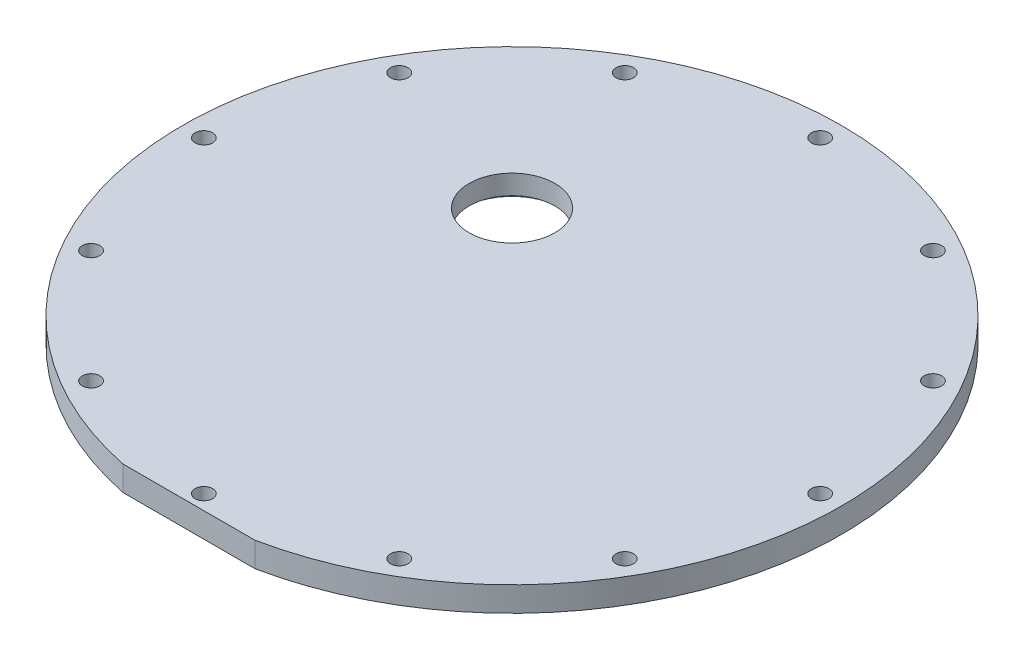
from build123d import *

# Parameters (mm, degrees)
SKETCH1_W               = 127
SKETCH1_H               = 9.525
F_1_4_CLEARANCE_HOLE1_D = 6.7564
CUT_EXTRUDE1_REACH      = 181.858
SKETCH4_W               = 50.8
SKETCH4_H               = 2.565921067
CUT_EXTRUDE2_REACH      = 181.858
SKETCH6_R               = 16.51
SKETCH7_R               = 19
CUT_EXTRUDE3_DEPTH      = 2


with BuildPart() as part:
    # Sketch1 → Revolve1 (revolve)
    with BuildSketch(Plane.XY, mode=Mode.PRIVATE) as revolve1_sk:
        with Locations((63.5, 4.7625)):
            Rectangle(SKETCH1_W, SKETCH1_H)
    revolve(revolve1_sk.sketch.rotate(Axis((0, 0, 0), (0, 1, 0)), 90), axis=Axis((0, 0, 0), (0, 1, 0)))

    # 1/4 Clearance Hole1 (through all)
    with Locations(Plane(origin=(0, 9.525, 0), x_dir=(1, 0, 0), z_dir=(0, 1, 0))):
        with Locations((0, 118.745), (59.3725, 102.836186572), (102.836186572, 59.3725), (118.745, 0), (102.836186572, -59.3725), (59.3725, -102.836186572), (0, -118.745), (-59.3725, -102.836186572), (-102.836186572, -59.3725), (-118.745, 0), (-102.836186572, 59.3725), (-59.3725, 102.836186572)):
            Hole(F_1_4_CLEARANCE_HOLE1_D / 2)

    # Sketch4 → Cut-Extrude1 (cut, up to next)
    with BuildSketch(Plane(origin=(0, 9.525, 0), x_dir=(1, 0, 0), z_dir=(0, 1, 0)), mode=Mode.PRIVATE) as cut_extrude1_sk1:
        with Locations((0, -125.717039467)):
            Rectangle(SKETCH4_W, SKETCH4_H)
    cut_extrude1_tool1 = extrude(cut_extrude1_sk1.sketch, amount=-CUT_EXTRUDE1_REACH, mode=Mode.PRIVATE) & part.part
    add(cut_extrude1_tool1.solids().sort_by_distance((0, 9.525, 125.717039))[0], mode=Mode.SUBTRACT)

    # Sketch6 → Cut-Extrude2 (cut, up to next)
    with BuildSketch(Plane.XZ, mode=Mode.PRIVATE) as cut_extrude2_sk1:
        with Locations(Location((-35.921024484, -35.921024484, 0), (0, 0, 270))):
            Circle(SKETCH6_R)
    cut_extrude2_tool1 = extrude(cut_extrude2_sk1.sketch, amount=-CUT_EXTRUDE2_REACH, mode=Mode.PRIVATE) & part.part
    add(cut_extrude2_tool1.solids().sort_by_distance((-35.921024, 0, -35.921024))[0], mode=Mode.SUBTRACT)

    # Sketch7 → Cut-Extrude3 (cut)
    with BuildSketch(Plane.XZ):
        with Locations(Location((-35.921024484, -35.921024484, 0), (0, 0, 270))):
            Circle(SKETCH7_R)
    extrude(amount=-CUT_EXTRUDE3_DEPTH, mode=Mode.SUBTRACT)


solid = part.part
